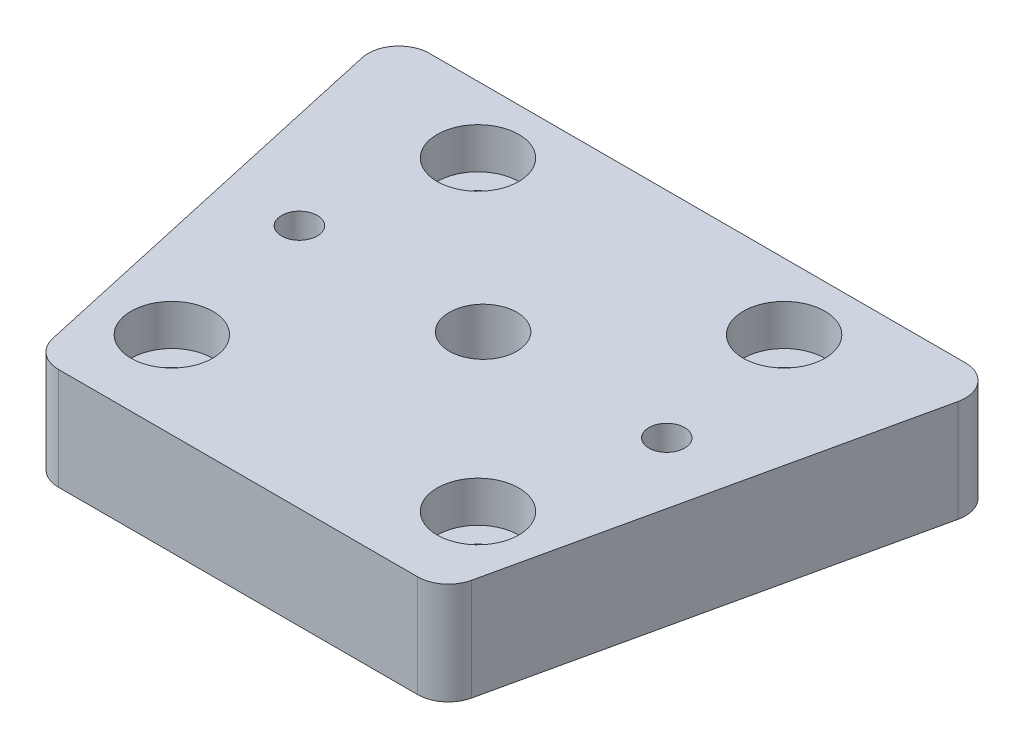
from build123d import *

# Parameters (mm, degrees)
BOSS_EXTRUDE2_DEPTH = 10
SKETCH4_R           = 4
CUT_EXTRUDE1_DEPTH  = 4
FILLET1_R           = 3
SKETCH5_R           = 1.75
SKETCH5_R_2         = 3.31
CUT_EXTRUDE2_DEPTH  = 10
SKETCH7_R           = 1.75
CUT_EXTRUDE3_DEPTH  = 10
SKETCH8_R           = 3.5
CUT_EXTRUDE4_DEPTH  = 3


with BuildPart() as part:
    # Sketch1 → Boss-Extrude2 (new body)
    with BuildSketch(Plane(origin=(0, 0, 0), x_dir=(1, 0, 0), z_dir=(0, 1, 0))):
        Polygon((0, 0), (10, -45), (50, -45), (60, 0), align=None)
    extrude(amount=BOSS_EXTRUDE2_DEPTH)

    # Sketch4 → Cut-Extrude1 (cut)
    with BuildSketch(Plane(origin=(0, 10, 0), x_dir=(1, 0, 0), z_dir=(0, 1, 0))):
        with Locations(Location((15, -6.5, 0), (0, 0, 270))):
            Circle(SKETCH4_R)
        with Locations(Location((45, -6.5, 0), (0, 0, 270))):
            Circle(SKETCH4_R)
        with Locations(Location((45, -36.5, 0), (0, 0, 270))):
            Circle(SKETCH4_R)
        with Locations(Location((15, -36.5, 0), (0, 0, 270))):
            Circle(SKETCH4_R)
    extrude(amount=-CUT_EXTRUDE1_DEPTH, mode=Mode.SUBTRACT)

    # Fillet1
    fillet1_edges = [part.edges().sort_by_distance(p)[0] for p in [
        (60, 5, 0),
        (50, 5, 45),
        (10, 5, 45),
        (0, 5, 0),
    ]]
    fillet(fillet1_edges, radius=FILLET1_R)

    # Sketch5 → Cut-Extrude2 (cut)
    with BuildSketch(Plane.XZ):
        with Locations(Location((12, 21, 0), (0, 0, 270))):
            Circle(SKETCH5_R)
        with Locations(Location((48, 21, 0), (0, 0, 270))):
            Circle(SKETCH5_R)
        with Locations(Location((30, 21, 0), (0, 0, 270))):
            Circle(SKETCH5_R_2)
    extrude(amount=-CUT_EXTRUDE2_DEPTH, mode=Mode.SUBTRACT)

    # Sketch7 → Cut-Extrude3 (cut)
    with BuildSketch(Plane(origin=(0, 10, 0), x_dir=(1, 0, 0), z_dir=(0, 1, 0))):
        with Locations(Location((15, -6.5, 0), (0, 0, 270))):
            Circle(SKETCH7_R)
        with Locations(Location((45, -6.5, 0), (0, 0, 270))):
            Circle(SKETCH7_R)
        with Locations(Location((45, -36.5, 0), (0, 0, 270))):
            Circle(SKETCH7_R)
        with Locations(Location((15, -36.5, 0), (0, 0, 270))):
            Circle(SKETCH7_R)
    extrude(amount=-CUT_EXTRUDE3_DEPTH, mode=Mode.SUBTRACT)

    # Sketch8 → Cut-Extrude4 (cut)
    with BuildSketch(Plane.XZ):
        with Locations(Location((15, 36.5, 0), (0, 0, 270))):
            Circle(SKETCH8_R)
        with Locations(Location((45, 36.5, 0), (0, 0, 270))):
            Circle(SKETCH8_R)
        with Locations(Location((45, 6.5, 0), (0, 0, 270))):
            Circle(SKETCH8_R)
        with Locations(Location((15, 6.5, 0), (0, 0, 270))):
            Circle(SKETCH8_R)
    extrude(amount=-CUT_EXTRUDE4_DEPTH, mode=Mode.SUBTRACT)


solid = part.part
